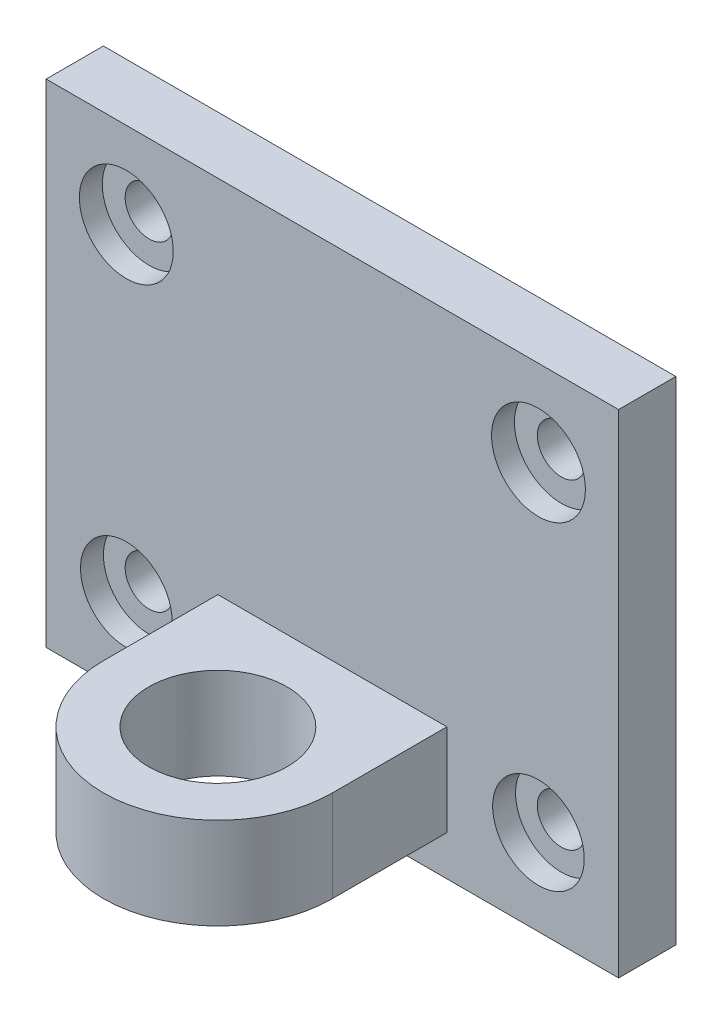
from build123d import *
from build123d.topology import SkipClean

# Parameters (mm, degrees)
SKETCH_1_R           = 2
EXTRUDE_1_DEPTH      = 5
EXTRUDE_5_DEPTH      = 18
SKETCH_6_W           = 40
SKETCH_6_H           = 5
EXTRUDE_6_DEPTH      = 25
SKETCH_7_W           = 40
SKETCH_7_H           = 5
EXTRUDE_7_DEPTH      = 27
SKETCH_9_R           = 10
CUT_EXTRUDE_4_DEPTH  = 50
SKETCH_10_W          = 8
SKETCH_10_H          = 5
EXTRUDE_9_DEPTH      = 20
CUT_EXTRUDE_8_DEPTH  = 20
CUT_EXTRUDE_9_DEPTH  = 20
SKETCH_16_W          = 40
SKETCH_16_H          = 4
EXTRUDE_10_DEPTH     = 5
SKETCH_17_W          = 40
SKETCH_17_H          = 4
EXTRUDE_12_DEPTH     = 12
SKETCH_18_R          = 1.5
CUT_EXTRUDE_10_DEPTH = 10
CUT_EXTRUDE_11_DEPTH = 10
SKETCH_22_W          = 39.912411086
SKETCH_22_H          = 12
CUT_EXTRUDE_12_DEPTH = 10
SKETCH_23_W          = 1.771441315
SKETCH_23_H          = 1.605869394
CUT_EXTRUDE_13_DEPTH = 10
SKETCH_24_W          = 40
SKETCH_24_H          = 4
EXTRUDE_13_DEPTH     = 7
SKETCH_26_R          = 1.5
CUT_EXTRUDE_14_DEPTH = 7
SKETCH_27_W          = 8
SKETCH_27_H          = 26.5
EXTRUDE_14_DEPTH     = 5
SKETCH_28_W          = 8
SKETCH_28_H          = 25
EXTRUDE_15_DEPTH     = 5
SKETCH_30_W          = 8
SKETCH_30_H          = 1.5
CUT_EXTRUDE_15_DEPTH = 5
SKETCH_31_R          = 2.52
CUT_EXTRUDE_16_DEPTH = 5
SKETCH_32_R          = 2.52
CUT_EXTRUDE_17_DEPTH = 5
CUT_EXTRUDE_18_DEPTH = 5
SKETCH_2_R           = 4
CUT_EXTRUDE_19_DEPTH = 3
SKETCH_35_W          = 4
SKETCH_35_H          = 12
CUT_EXTRUDE_20_DEPTH = 100
SKETCH_37_W          = 50
SKETCH_37_H          = 43
CUT_EXTRUDE_21_DEPTH = 100
SKETCH_38_W          = 50
SKETCH_38_H          = 43
SKETCH_38_R          = 10
EXTRUDE_20_DEPTH     = 5
SKETCH_39_W          = 50
SKETCH_39_H          = 43
SKETCH_39_W_2        = 40
SKETCH_39_H_2        = 30
EXTRUDE_21_DEPTH     = 5
CUT_EXTRUDE_START    = -100
SKETCH_41_R          = 2.1
SKETCH_41_R_2        = 10
CUT_EXTRUDE_23_DEPTH = 100
SKETCH_42_W          = 6
SKETCH_42_H          = 5
CUT_EXTRUDE_24_DEPTH = 13
SKETCH_43_R          = 4.1
CUT_EXTRUDE_27_DEPTH = 29
EXTRUDE_START        = 27
EXTRUDE_22_DEPTH     = 27
EXTRUDE_23_DEPTH     = 27
SKETCH_46_W          = 28
SKETCH_46_H          = 0.25
EXTRUDE_24_DEPTH     = 20
SKETCH_47_R          = 4
CUT_EXTRUDE_28_DEPTH = 2
CUT_EXTRUDE_29_DEPTH = 10
CUT_EXTRUDE_30_DEPTH = 10
SKETCH_50_W          = 27
SKETCH_50_H          = 11.6
SKETCH_50_H_2        = 10.600731696
SKETCH_50_W_2        = 5
SKETCH_50_H_3        = 9.36628082
CUT_EXTRUDE_31_DEPTH = 60
SKETCH_51_R          = 10
SKETCH_51_W          = 5.257466337
SKETCH_51_H          = 20
SKETCH_51_W_2        = 5.257304599
EXTRUDE_25_DEPTH     = 10
SKETCH_52_W          = 5
SKETCH_52_H          = 43
CUT_EXTRUDE_32_DEPTH = 50
EXTRUDE_26_DEPTH     = 20
SKETCH_57_R          = 6.05
CUT_EXTRUDE_33_DEPTH = 20


with BuildPart() as part:
    # 草图1 → 凸台-拉伸1 (new body)
    with BuildSketch(Plane.XY):
        Polygon((0, 21.5), (25, 21.5), (25, -21.5), (-25, -21.5), (-25, 21.5), align=None)
        with Locations((-18, 14)):
            Circle(SKETCH_1_R, mode=Mode.SUBTRACT)
        with Locations((-18, -14)):
            Circle(SKETCH_1_R, mode=Mode.SUBTRACT)
        with Locations((18, -14)):
            Circle(SKETCH_1_R, mode=Mode.SUBTRACT)
        with Locations((18, 14)):
            Circle(SKETCH_1_R, mode=Mode.SUBTRACT)
    extrude(amount=EXTRUDE_1_DEPTH)

    # 草图5 → 凸台-拉伸5 (add)
    with BuildSketch(Plane.XY.offset(5)):
        Polygon((0, 26.5), (20, 26.5), (20, 21.5), (-20, 21.5), (-20, 26.5), align=None)
    extrude(amount=-EXTRUDE_5_DEPTH)

    # 草图6 → 凸台-拉伸6 (add)
    with BuildSketch(Plane(origin=(0, 26.5, 0), x_dir=(1, 0, 0), z_dir=(0, 1, 0))):
        with Locations((0, 10.5)):
            Rectangle(SKETCH_6_W, SKETCH_6_H)
    extrude(amount=EXTRUDE_6_DEPTH)

    # 草图7 → 凸台-拉伸7 (add)
    with BuildSketch(Plane.XY.offset(-8)):
        with Locations((0, 49)):
            Rectangle(SKETCH_7_W, SKETCH_7_H)
    extrude(amount=EXTRUDE_7_DEPTH)

    # 草图9 → 切除-拉伸4 (cut)
    with BuildSketch(Plane(origin=(0, 0, 0), x_dir=(-1, 0, 0), z_dir=(0, 0, -1))):
        Circle(SKETCH_9_R)
    extrude(amount=-CUT_EXTRUDE_4_DEPTH, mode=Mode.SUBTRACT)

    # 草图10 → 凸台-拉伸9 (add)
    with BuildSketch(Plane(origin=(0, 51.5, 0), x_dir=(1, 0, 0), z_dir=(0, 1, 0))):
        with Locations((-24, -16.5)):
            Rectangle(SKETCH_10_W, SKETCH_10_H)
        with Locations((24, -16.5)):
            Rectangle(SKETCH_10_W, SKETCH_10_H)
    extrude(amount=-EXTRUDE_9_DEPTH)

    # 草图12 → 切除-拉伸8 (cut)
    with BuildSketch(Plane(origin=(0, 0, 14), x_dir=(-1, 0, 0), z_dir=(0, 0, -1))):
        with BuildLine():
            Line((28, 46), (28, 47))
            Line((28, 47), (27.949489743, 47))
            ThreePointArc((27.949489743, 47), (23, 46.5), (27.949489743, 46))
            Line((27.949489743, 46), (28, 46))
        make_face()
        with BuildLine():
            Line((27.949489743, 36), (28, 36))
            Line((28, 36), (28, 37))
            Line((28, 37), (27.949489743, 37))
            ThreePointArc((27.949489743, 37), (23, 36.5), (27.949489743, 36))
        make_face()
    extrude(amount=-CUT_EXTRUDE_8_DEPTH, mode=Mode.SUBTRACT)

    # 草图15 → 切除-拉伸9 (cut)
    with BuildSketch(Plane(origin=(0, 0, 14), x_dir=(-1, 0, 0), z_dir=(0, 0, -1))):
        with BuildLine():
            ThreePointArc((-27.949489743, 46), (-23, 46.5), (-27.949489743, 47))
            Line((-27.949489743, 47), (-28, 47))
            Line((-28, 47), (-28, 46))
            Line((-28, 46), (-27.949489743, 46))
        make_face()
        with BuildLine():
            Line((-27.949489743, 37), (-28, 37))
            Line((-28, 37), (-28, 36))
            Line((-28, 36), (-27.949489743, 36))
            ThreePointArc((-27.949489743, 36), (-23, 36.5), (-27.949489743, 37))
        make_face()
    extrude(amount=-CUT_EXTRUDE_9_DEPTH, mode=Mode.SUBTRACT)

    # 草图16 → 凸台-拉伸10 (add)
    with BuildSketch(Plane(origin=(0, 51.5, 0), x_dir=(1, 0, 0), z_dir=(0, 1, 0))):
        with Locations((0, -21)):
            Rectangle(SKETCH_16_W, SKETCH_16_H)
    extrude(amount=-EXTRUDE_10_DEPTH)

    # 草图17 → 凸台-拉伸12 (add)
    with BuildSketch(Plane(origin=(0, 51.5, 0), x_dir=(1, 0, 0), z_dir=(0, 1, 0))):
        with Locations((0, -21)):
            Rectangle(SKETCH_17_W, SKETCH_17_H)
    extrude(amount=EXTRUDE_12_DEPTH)

    # 草图18 → 切除-拉伸10 (cut)
    with BuildSketch(Plane(origin=(0, 0, 19), x_dir=(-1, 0, 0), z_dir=(0, 0, -1))):
        with Locations((6, 59.5)):
            Circle(SKETCH_18_R)
        with Locations((13, 59.5)):
            Circle(SKETCH_18_R)
    extrude(amount=-CUT_EXTRUDE_10_DEPTH, mode=Mode.SUBTRACT)

    # 草图20 → 切除-拉伸11 (cut)
    with BuildSketch(Plane.XY.offset(23)):
        with BuildLine():
            ThreePointArc((8, 63.5), (16.485281374, 59.985281374), (20, 51.5))
            Line((20, 51.5), (20, 63.5))
            Line((20, 63.5), (8, 63.5))
        make_face()
    extrude(amount=-CUT_EXTRUDE_11_DEPTH, mode=Mode.SUBTRACT)

    # 草图22 → 切除-拉伸12 (cut)
    with BuildSketch(Plane.XY.offset(23)):
        with Locations((-0.043794457, 57.5)):
            Rectangle(SKETCH_22_W, SKETCH_22_H)
    extrude(amount=-CUT_EXTRUDE_12_DEPTH, mode=Mode.SUBTRACT)

    # 草图23 → 切除-拉伸13 (cut)
    with BuildSketch(Plane.XY.offset(23)):
        with Locations((20.269466875, 52.302934697)):
            Rectangle(SKETCH_23_W, SKETCH_23_H)
    extrude(amount=-CUT_EXTRUDE_13_DEPTH, mode=Mode.SUBTRACT)

    # 草图24 → 凸台-拉伸13 (add)
    with BuildSketch(Plane(origin=(0, 51.5, 0), x_dir=(1, 0, 0), z_dir=(0, 1, 0))):
        with Locations((0, -21)):
            Rectangle(SKETCH_24_W, SKETCH_24_H)
    extrude(amount=EXTRUDE_13_DEPTH)

    # 草图26 → 切除-拉伸14 (cut)
    with BuildSketch(Plane.XY.offset(23)):
        with Locations((-13, 54.5)):
            Circle(SKETCH_26_R)
        with Locations((-6, 54.5)):
            Circle(SKETCH_26_R)
    extrude(amount=-CUT_EXTRUDE_14_DEPTH, mode=Mode.SUBTRACT)

    # 草图27 → 凸台-拉伸14 (add)
    with BuildSketch(Plane.XY.offset(19)):
        with Locations((24, 38.25)):
            Rectangle(SKETCH_27_W, SKETCH_27_H)
    extrude(amount=-EXTRUDE_14_DEPTH)

    # 草图28 → 凸台-拉伸15 (add)
    with BuildSketch(Plane.XY.offset(19)):
        with Locations((-24, 39)):
            Rectangle(SKETCH_28_W, SKETCH_28_H)
    extrude(amount=-EXTRUDE_15_DEPTH)

    # 草图30 → 切除-拉伸15 (cut)
    with BuildSketch(Plane.XY.offset(19)):
        with Locations((24, 25.75)):
            Rectangle(SKETCH_30_W, SKETCH_30_H)
    extrude(amount=-CUT_EXTRUDE_15_DEPTH, mode=Mode.SUBTRACT)

    # 草图31 → 切除-拉伸16 (cut)
    with BuildSketch(Plane.XY.offset(19)):
        with Locations((25.5, 41.5)):
            Circle(SKETCH_31_R)
        with Locations((25.5, 31.5)):
            Circle(SKETCH_31_R)
    extrude(amount=-CUT_EXTRUDE_16_DEPTH, mode=Mode.SUBTRACT)

    # 草图32 → 切除-拉伸17 (cut)
    with BuildSketch(Plane.XY.offset(19)):
        with Locations((-25.5, 41.5)):
            Circle(SKETCH_32_R)
        with Locations((-25.5, 31.5)):
            Circle(SKETCH_32_R)
    extrude(amount=-CUT_EXTRUDE_17_DEPTH, mode=Mode.SUBTRACT)

    # 草图33 → 切除-拉伸18 (cut)
    with BuildSketch(Plane(origin=(0, 0, 19), x_dir=(-1, 0, 0), z_dir=(0, 0, -1))):
        with BuildLine():
            Line((-20, 58.5), (-20, 51.5))
            ThreePointArc((-20, 51.5), (-17.949747468, 56.449747468), (-13, 58.5))
            Line((-13, 58.5), (-20, 58.5))
        make_face()
        with BuildLine():
            Line((20, 58.5), (13, 58.5))
            ThreePointArc((13, 58.5), (17.949747468, 56.449747468), (20, 51.5))
            Line((20, 51.5), (20, 58.5))
        make_face()
    extrude(amount=-CUT_EXTRUDE_18_DEPTH, mode=Mode.SUBTRACT)

    # 草图2 → 切除-拉伸19 (cut)
    with BuildSketch(Plane.XY.offset(5)):
        with Locations((18, 14)):
            Circle(SKETCH_2_R)
        with Locations((-18, 14)):
            Circle(SKETCH_2_R)
        with Locations((-18, -14)):
            Circle(SKETCH_2_R)
        with Locations((18, -14)):
            Circle(SKETCH_2_R)
    extrude(amount=-CUT_EXTRUDE_19_DEPTH, mode=Mode.SUBTRACT)

    # 草图35 → 切除-拉伸20 (cut)
    with BuildSketch(Plane.ZY.offset(20)):
        with Locations((21, 52.5)):
            Rectangle(SKETCH_35_W, SKETCH_35_H)
    extrude(amount=-CUT_EXTRUDE_20_DEPTH, mode=Mode.SUBTRACT)

    # 草图37 → 切除-拉伸21 (cut)
    with BuildSketch(Plane.XY.offset(5)):
        Rectangle(SKETCH_37_W, SKETCH_37_H)
    extrude(amount=-CUT_EXTRUDE_21_DEPTH, mode=Mode.SUBTRACT)

    # 草图38 → 凸台-拉伸20 (add)
    with BuildSketch(Plane(origin=(0, 0, -13), x_dir=(-1, 0, 0), z_dir=(0, 0, -1))):
        with Locations((0, 36.5)):
            Rectangle(SKETCH_38_W, SKETCH_38_H)
        with Locations((0, 36.5)):
            Circle(SKETCH_38_R, mode=Mode.SUBTRACT)
    extrude(amount=EXTRUDE_20_DEPTH)

    # 草图39 → 凸台-拉伸21 (add)
    with BuildSketch(Plane.XY.offset(-13)):
        with Locations((0, 36.5)):
            Rectangle(SKETCH_39_W, SKETCH_39_H)
        with Locations((0, 36.5)):
            Rectangle(SKETCH_39_W_2, SKETCH_39_H_2, mode=Mode.SUBTRACT)
    extrude(amount=EXTRUDE_21_DEPTH)

    # 草图41 → 切除-拉伸23 (cut)
    with BuildSketch(Plane(origin=(0, 0, -18), x_dir=(-1, 0, 0), z_dir=(0, 0, -1)).offset(CUT_EXTRUDE_START)):
        with Locations((-18, 50.5)):
            Circle(SKETCH_41_R)
        with Locations((18, 50.5)):
            Circle(SKETCH_41_R)
        with Locations((18, 22.5)):
            Circle(SKETCH_41_R)
        with Locations((-18, 22.5)):
            Circle(SKETCH_41_R)
        with Locations(Location((0, 36.5, 0), (0, 0, 270))):
            Circle(SKETCH_41_R_2)
    extrude(amount=CUT_EXTRUDE_23_DEPTH, mode=Mode.SUBTRACT)

    # 草图42 → 切除-拉伸24 (cut)
    with BuildSketch(Plane.XY.offset(5)):
        with Locations((-17, 24)):
            Rectangle(SKETCH_42_W, SKETCH_42_H)
        with Locations((17, 24)):
            Rectangle(SKETCH_42_W, SKETCH_42_H)
    extrude(amount=-CUT_EXTRUDE_24_DEPTH, mode=Mode.SUBTRACT)

    # 草图43 → 切除-拉伸27 (cut)
    with BuildSketch(Plane.XY.offset(19)):
        with Locations((-18, 50.5)):
            Circle(SKETCH_43_R)
        with Locations((18, 50.5)):
            Circle(SKETCH_43_R)
    extrude(amount=-CUT_EXTRUDE_27_DEPTH, mode=Mode.SUBTRACT)

    # 草图44 → 凸台-拉伸22 (add)
    with SkipClean():  # the faces are left unmerged after this step: merging them gives an invalid solid
        with BuildSketch(Plane.XY.offset(-8).offset(EXTRUDE_START)):
            with BuildLine():
                Line((-25, 46.5), (-20, 46.5))
                Line((-20, 46.5), (-20, 46.920893966))
                ThreePointArc((-20, 46.920893966), (-22.1, 50.5), (-20, 54.079106034))
                Line((-20, 54.079106034), (-20, 58))
                Line((-20, 58), (-25, 58))
                Line((-25, 58), (-25, 46.5))
            make_face()
        extrude(amount=-EXTRUDE_22_DEPTH)

    # 草图45 → 凸台-拉伸23 (add)
    with SkipClean():  # the faces are left unmerged after this step: merging them gives an invalid solid
        with BuildSketch(Plane.XY.offset(-8).offset(EXTRUDE_START)):
            with BuildLine():
                Line((18.9, 46.5), (25, 46.5))
                Line((25, 46.5), (25, 58))
                Line((25, 58), (20, 58))
                Line((20, 58), (20, 54.079106034))
                ThreePointArc((20, 54.079106034), (22.057488307, 49.911112372), (18.9, 46.5))
            make_face()
        extrude(amount=-EXTRUDE_23_DEPTH)

    # 草图46 → 凸台-拉伸24 (add)
    with SkipClean():  # the faces are left unmerged after this step: merging them gives an invalid solid
        with BuildSketch(Plane.XY.offset(5)):
            with Locations((0, 26.625)):
                Rectangle(SKETCH_46_W, SKETCH_46_H)
        extrude(amount=-EXTRUDE_24_DEPTH)

    # 草图47 → 切除-拉伸28 (cut)
    with SkipClean():  # the faces are left unmerged after this step: merging them gives an invalid solid
        with BuildSketch(Plane.XY.offset(-8)):
            with Locations((-18, 22.5)):
                Circle(SKETCH_47_R)
            with Locations((18, 22.5)):
                Circle(SKETCH_47_R)
        extrude(amount=-CUT_EXTRUDE_28_DEPTH, mode=Mode.SUBTRACT)

    # 草图48 → 切除-拉伸29 (cut)
    with SkipClean():  # the faces are left unmerged after this step: merging them gives an invalid solid
        with BuildSketch(Plane.XY.offset(-8)):
            with BuildLine():
                Line((-25, 46.5), (-25, 26.5))
                ThreePointArc((-25, 26.5), (-19.999999498, 36.5), (-25, 46.5))
            make_face()
        extrude(amount=-CUT_EXTRUDE_29_DEPTH, mode=Mode.SUBTRACT)

    # 草图49 → 切除-拉伸30 (cut)
    with SkipClean():  # the faces are left unmerged after this step: merging them gives an invalid solid
        with BuildSketch(Plane.XY.offset(-8)):
            with BuildLine():
                Line((25, 46.5), (25, 26.5))
                ThreePointArc((25, 26.5), (20, 36.5), (25, 46.5))
            make_face()
        extrude(amount=-CUT_EXTRUDE_30_DEPTH, mode=Mode.SUBTRACT)

    # 草图50 → 切除-拉伸31 (cut)
    with BuildSketch(Plane.ZY.offset(28)):
        with Locations((5.5, 52.2)):
            Rectangle(SKETCH_50_W, SKETCH_50_H)
        Polygon((-8, 26.5), (19, 26.5), (19, 31.81685959), (14, 31.81685959), (14, 41.18314041), (19, 41.18314041), (19, 46.4), (-8, 46.4), align=None)
        with Locations((5.5, 21.199634152)):
            Rectangle(SKETCH_50_W, SKETCH_50_H_2)
        with Locations((16.5, 36.5)):
            Rectangle(SKETCH_50_W_2, SKETCH_50_H_3)
    extrude(amount=-CUT_EXTRUDE_31_DEPTH, mode=Mode.SUBTRACT)

    # 草图51 → 凸台-拉伸25 (add)
    with BuildSketch(Plane.XY.offset(-8)):
        with Locations((0, 36.5)):
            Circle(SKETCH_51_R)
        with Locations((-22.371266832, 36.5)):
            Rectangle(SKETCH_51_W, SKETCH_51_H)
        with Locations((22.371347701, 36.5)):
            Rectangle(SKETCH_51_W_2, SKETCH_51_H)
    extrude(amount=-EXTRUDE_25_DEPTH)

    # 草图52 → 切除-拉伸32 (cut)
    with BuildSketch(Plane.ZY.offset(25)):
        with Locations((-15.5, 36.5)):
            Rectangle(SKETCH_52_W, SKETCH_52_H)
    extrude(amount=-CUT_EXTRUDE_32_DEPTH, mode=Mode.SUBTRACT)

    # 草图53 → 凸台-拉伸26 (add)
    with BuildSketch(Plane.XY.offset(-8)):
        Polygon((-10, 22.5), (-10, 26.5), (10, 26.5), (10, 22.5), (10, 18.5), (-10, 18.5), align=None)
    extrude(amount=EXTRUDE_26_DEPTH)

    # 草图57 → 切除-拉伸33 (cut)
    with BuildSketch(Plane(origin=(0, 26.5, 0), x_dir=(1, 0, 0), z_dir=(0, 1, 0))):
        with Locations(Location((0, -2, 0), (0, 0, 270))):
            Circle(SKETCH_57_R)
        with BuildLine():
            ThreePointArc((0, -12), (-7.071067812, -9.071067812), (-10, -2))
            Line((-10, -2), (-10, -12))
            Line((-10, -12), (0, -12))
        make_face()
        with BuildLine():
            ThreePointArc((10, -2), (7.071067812, -9.071067812), (0, -12))
            Line((0, -12), (10, -12))
            Line((10, -12), (10, -2))
        make_face()
    extrude(amount=-CUT_EXTRUDE_33_DEPTH, mode=Mode.SUBTRACT)


solid = part.part
